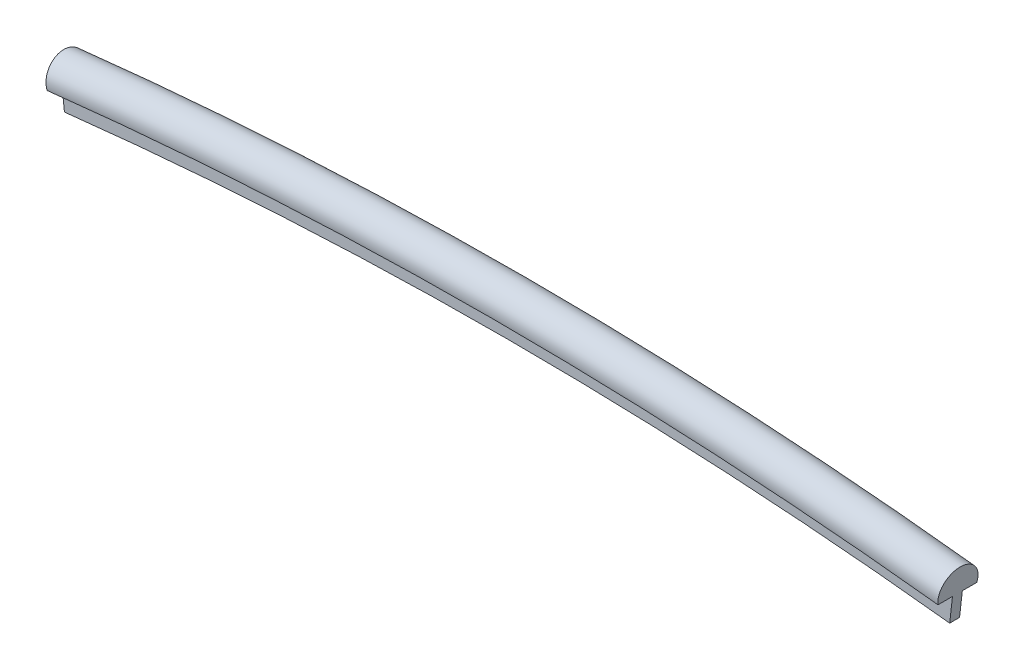
from build123d import *

# Parameters (mm, degrees)
REVOLVE1_ANGLE           = 6.446671064
REVOLVE1_OTHER_WAY_ANGLE = 6.446671064


with BuildPart() as part:
    # Sketch2 → Revolve1 (revolve)
    with BuildSketch(Plane(origin=(0, 0, 0), x_dir=(0, 0, -1), z_dir=(1, 0, 0))):
        with BuildLine():
            Line((0, 239.8), (0.3, 239.8))
            Line((0.3, 239.8), (0.3, 241.3))
            Line((0.3, 241.3), (1.18, 241.3))
            ThreePointArc((1.18, 241.3), (0, 242.800182019), (-1.18, 241.3))
            Line((-1.18, 241.3), (-0.3, 241.3))
            Line((-0.3, 241.3), (-0.3, 239.8))
            Line((-0.3, 239.8), (0, 239.8))
        make_face()
    revolve(axis=Axis((0, 0, 70.597641597), (0, 0, -1)), revolution_arc=REVOLVE1_ANGLE)

    # Sketch2 → Revolve1 other way (revolve)
    with BuildSketch(Plane(origin=(0, 0, 0), x_dir=(0, 0, -1), z_dir=(1, 0, 0))):
        with BuildLine():
            Line((0, 239.8), (0.3, 239.8))
            Line((0.3, 239.8), (0.3, 241.3))
            Line((0.3, 241.3), (1.18, 241.3))
            ThreePointArc((1.18, 241.3), (0, 242.800182019), (-1.18, 241.3))
            Line((-1.18, 241.3), (-0.3, 241.3))
            Line((-0.3, 241.3), (-0.3, 239.8))
            Line((-0.3, 239.8), (0, 239.8))
        make_face()
    revolve(axis=Axis((0, 0, 70.597641597), (0, 0, 1)), revolution_arc=REVOLVE1_OTHER_WAY_ANGLE)


solid = part.part
